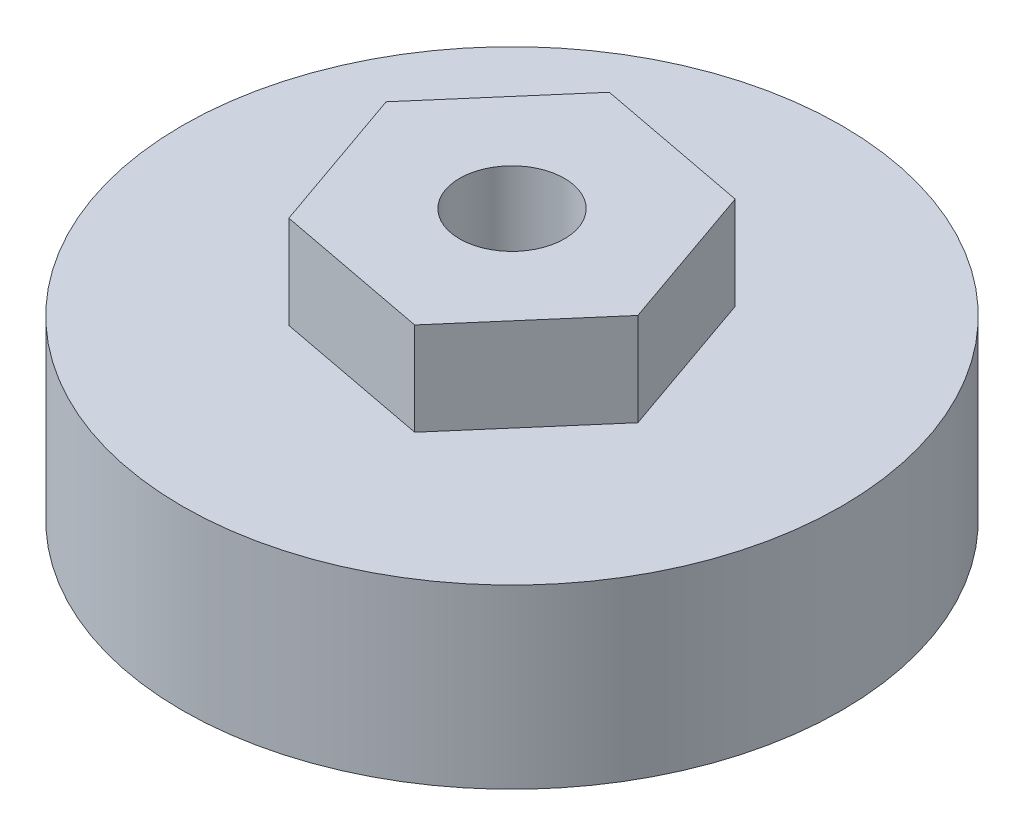
from build123d import *

# Parameters (mm, degrees)
SKETCH1_R           = 10.999999971
BOSS_EXTRUDE1_DEPTH = 9.000000034
SKETCH2_OUTSIDE_W   = 30.478
SKETCH2_OUTSIDE_H   = 30.478
CUT_EXTRUDE1_DEPTH  = 3.10000015
SKETCH3_R           = 1.750000056
CUT_EXTRUDE2_DEPTH  = 18.972200737


with BuildPart() as part:
    # Sketch1 → Boss-Extrude1 (new body)
    with BuildSketch(Plane(origin=(0, 0, 0), x_dir=(1, 0, 0), z_dir=(0, 1, 0))):
        with Locations(Location((0, 0, 0), (0, 0, 270))):
            Circle(SKETCH1_R)
    extrude(amount=BOSS_EXTRUDE1_DEPTH)

    # Sketch2 outside → Cut-Extrude1 (cut)
    with BuildSketch(Plane(origin=(0, 9.000000034, 0), x_dir=(1, 0, 0), z_dir=(0, 1, 0))):
        Rectangle(SKETCH2_OUTSIDE_W, SKETCH2_OUTSIDE_H)
        Polygon((3.447675766, 3.998055004), (-1.738579316, 4.984802299), (-5.186255082, 0.986747295), (-3.447675766, -3.998055004), (1.738579316, -4.984802299), (5.186255082, -0.986747295), align=None, mode=Mode.SUBTRACT)
    extrude(amount=-CUT_EXTRUDE1_DEPTH, mode=Mode.SUBTRACT)

    # Sketch3 → Cut-Extrude2 (cut, through all)
    with BuildSketch(Plane(origin=(0, 9.000000034, 0), x_dir=(1, 0, 0), z_dir=(0, 1, 0))):
        with Locations(Location((0, 0, 0), (0, 0, 270))):
            Circle(SKETCH3_R)
    extrude(amount=-CUT_EXTRUDE2_DEPTH, mode=Mode.SUBTRACT)


solid = part.part
